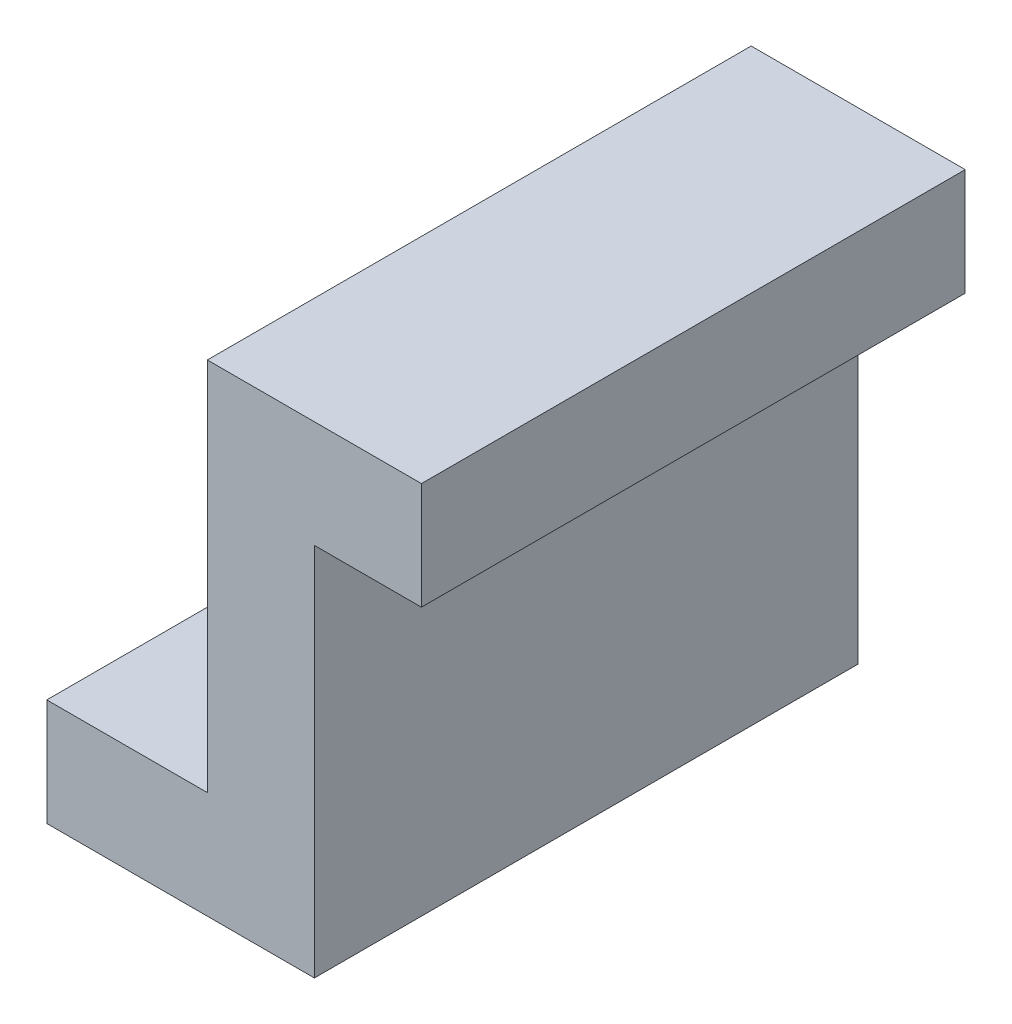
from build123d import *

# Parameters (mm, degrees)
EXTRUIR_L_MINA1_DEPTH = 25.4
CROQUIS2_R            = 4.7625
CORTAR_EXTRUIR1_DEPTH = 56.634162167


with BuildPart() as part:
    # Croquis1 → Extruir-Lámina1 (new, symmetric)
    with BuildSketch(Plane.XY):
        Polygon((0, 0), (25, 0), (25, 35), (35, 35), (35, 45), (15, 45), (15, 10), (0, 10), align=None)
    extrude(amount=EXTRUIR_L_MINA1_DEPTH, both=True)

    # Croquis2 → Cortar-Extruir1 (cut, through all)
    with BuildSketch(Plane(origin=(0, 10, 0), x_dir=(1, 0, 0), z_dir=(0, 1, 0))):
        with Locations(Location((7.5, 0, 0), (0, 0, 270))):
            Circle(CROQUIS2_R)
    extrude(amount=-CORTAR_EXTRUIR1_DEPTH, mode=Mode.SUBTRACT)


solid = part.part
